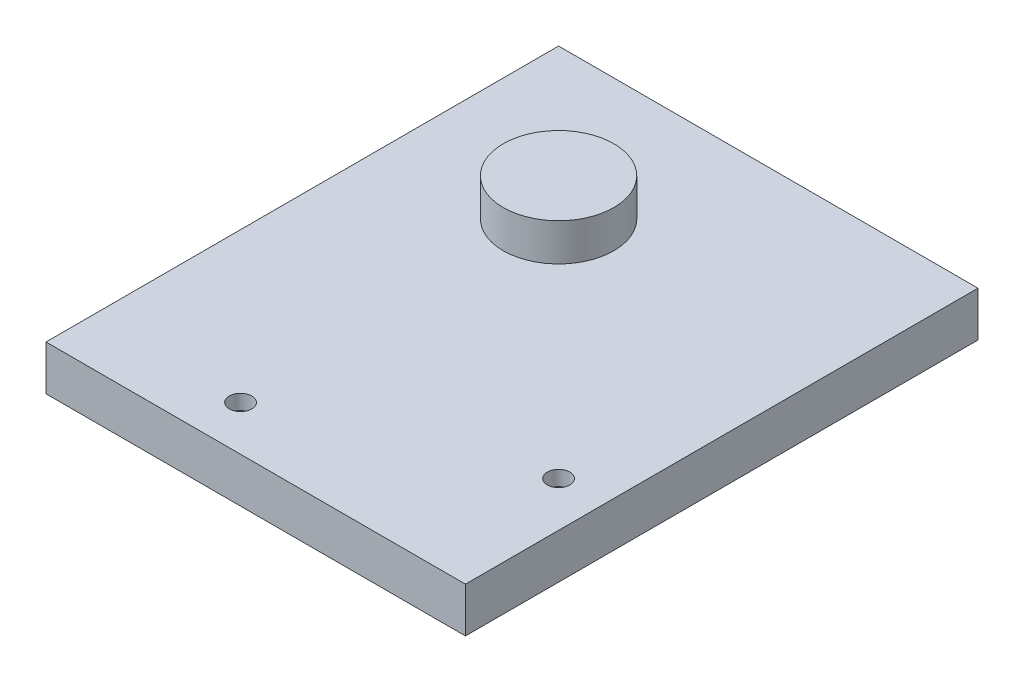
from build123d import *

# Parameters (mm, degrees)
SKETCH1_W           = 56.0520382
SKETCH1_H           = 68.5
SKETCH1_R           = 1.5
BOSS_EXTRUDE1_DEPTH = 6
SKETCH1_3_R         = 7.39
BOSS_EXTRUDE2_DEPTH = 5
CUT_EXTRUDE1_START  = -4
SKETCH2_R           = 1.95
SKETCH2_R_2         = 1.5
CUT_EXTRUDE1_DEPTH  = 4


with BuildPart() as part:
    # Sketch1 → Boss-Extrude1 (new body)
    with BuildSketch(Plane(origin=(0, 0, 0), x_dir=(1, 0, 0), z_dir=(0, 1, 0))):
        with Locations((8.0260191, -14.25)):
            Rectangle(SKETCH1_W, SKETCH1_H)
        with Locations((0, -42.5)):
            Circle(SKETCH1_R, mode=Mode.SUBTRACT)
        with Locations((30.0520382, -30.0520382)):
            Circle(SKETCH1_R, mode=Mode.SUBTRACT)
    extrude(amount=-BOSS_EXTRUDE1_DEPTH)

    # Sketch1<3> → Boss-Extrude2 (add)
    with BuildSketch(Plane(origin=(0, 0, 0), x_dir=(1, 0, 0), z_dir=(0, 1, 0))):
        Circle(SKETCH1_3_R)
    extrude(amount=BOSS_EXTRUDE2_DEPTH)

    # Sketch2 → Cut-Extrude1 (cut)
    # profile 1 of 2: a face of its own
    with BuildSketch(Plane.XZ.offset(6).offset(CUT_EXTRUDE1_START)):
        with Locations((0, 42.5)):
            Circle(SKETCH2_R)
        with Locations((0, 42.5)):
            Circle(SKETCH2_R_2, mode=Mode.SUBTRACT)
    # profile 2 of 2: a face of its own
    with BuildSketch(Plane.XZ.offset(6).offset(CUT_EXTRUDE1_START)):
        with Locations((30.0520382, 30.0520382)):
            Circle(SKETCH2_R)
        with Locations((30.0520382, 30.0520382)):
            Circle(SKETCH2_R_2, mode=Mode.SUBTRACT)
    extrude(amount=CUT_EXTRUDE1_DEPTH, mode=Mode.SUBTRACT)


solid = part.part
